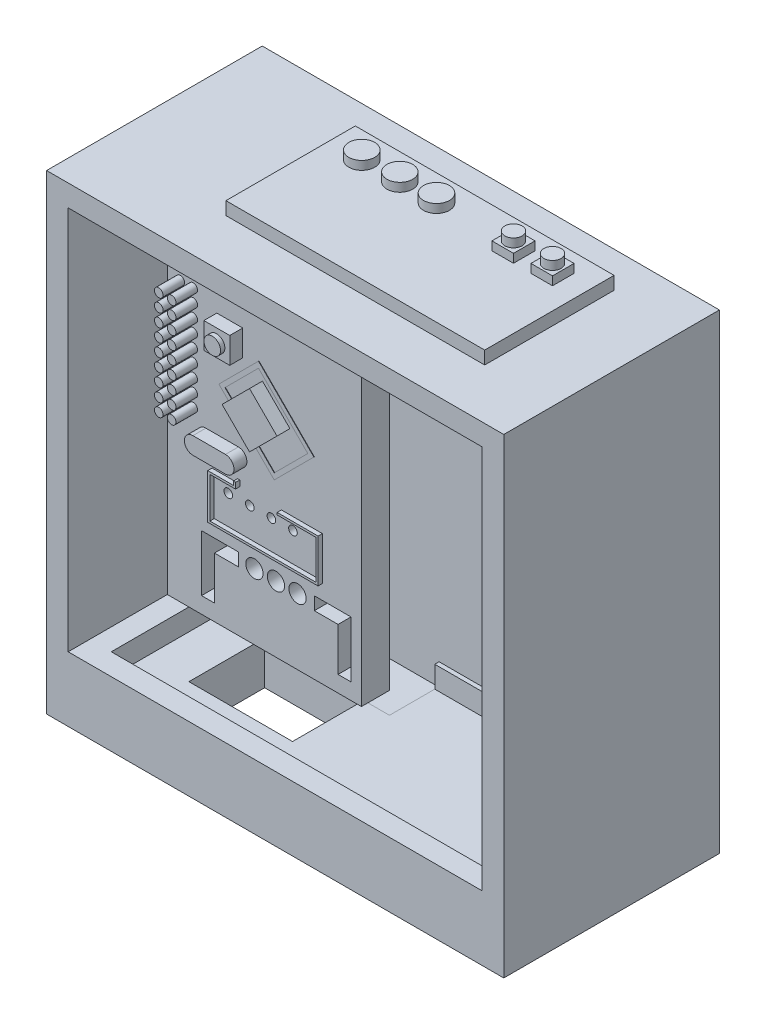
from build123d import *

# Parameters (mm, degrees)
SKETCH_1_W           = 106
SKETCH_1_H           = 45
EXTRUDE_1_DEPTH      = 200
SKETCH_2_W           = 86
SKETCH_2_H           = 180
CUT_EXTRUDE_1_DEPTH  = 35
SKETCH_4_W           = 24.030592061
SKETCH_4_H           = 7.207958271
CUT_EXTRUDE_4_DEPTH  = 35
SKETCH_5_W           = 106
SKETCH_5_H           = 200
EXTRUDE_2_DEPTH      = 5
SKETCH_6_W           = 96
SKETCH_6_H           = 180
CUT_EXTRUDE_5_DEPTH  = 41
SKETCH_7_W           = 45
SKETCH_7_H           = 70
EXTRUDE_3_DEPTH      = 18
SKETCH_8_W           = 24.030592061
SKETCH_8_H           = 17.559762173
CUT_EXTRUDE_6_DEPTH  = 15
SKETCH_9_R           = 3.5
CUT_EXTRUDE_7_DEPTH  = 211.926527492
SKETCH_11_W          = 6
SKETCH_11_H          = 6
SKETCH_11_R          = 1.925381926
EXTRUDE_5_DEPTH      = 3
SKETCH_12_R          = 1.925381926
EXTRUDE_6_DEPTH      = 1
EXTRUDE_7_DEPTH      = 3
EXTRUDE_12_DEPTH     = 3
SKETCH_23_R          = 2
CUT_EXTRUDE_8_DEPTH  = 12
EXTRUDE_1_2_DEPTH    = 0.1
SKETCH_25_W          = 45
SKETCH_25_H          = 5
CUT_EXTRUDE_9_DEPTH  = 75.1
SKETCH_26_W          = 45
SKETCH_26_H          = 6.5
CUT_EXTRUDE_10_DEPTH = 75.1
EXTRUDE_4_DEPTH      = 5
EXTRUDE_4_DEPTH_BACK = 15.1
SKETCH_10_R          = 1
EXTRUDE_14_DEPTH     = 1
SKETCH_28_R          = 1
CUT_EXTRUDE_11_DEPTH = 12.1
SKETCH_39_R          = 6
EXTRUDE_22_DEPTH     = 60
SKETCH_40_W          = 7.376516637
SKETCH_40_H          = 1.927531986
CUT_EXTRUDE_12_DEPTH = 23
SKETCH_41_W          = 4.263187749
SKETCH_41_H          = 1.482847913
CUT_EXTRUDE_13_DEPTH = 23
EXTRUDE_23_DEPTH     = 200
SKETCH_43_R          = 5.333844502
EXTRUDE_24_DEPTH     = 200
CUT_EXTRUDE_14_DEPTH = 207
SKETCH_48_W          = 106
SKETCH_48_H          = 95.860653934
CUT_EXTRUDE_17_DEPTH = 213.859108332
SKETCH_49_W          = 106
SKETCH_49_H          = 50
EXTRUDE_25_DEPTH     = 5
SKETCH_50_W          = 60
SKETCH_50_H          = 30
EXTRUDE_26_DEPTH     = 3
SKETCH_51_R          = 3
EXTRUDE_27_DEPTH     = 2
SKETCH_52_R          = 2.9857654
EXTRUDE_28_DEPTH     = 2
SKETCH_53_R          = 3
EXTRUDE_29_DEPTH     = 2
SKETCH_54_W          = 5
SKETCH_54_H          = 5
EXTRUDE_30_DEPTH     = 2
SKETCH_55_R          = 2
EXTRUDE_31_DEPTH     = 2


with BuildPart() as part:
    # 草圖1 → Extrude 1 (new body)
    with BuildSketch(Plane(origin=(0, 0, 0), x_dir=(1, 0, 0), z_dir=(0, 1, 0))):
        Rectangle(SKETCH_1_W, SKETCH_1_H)
    extrude(amount=EXTRUDE_1_DEPTH)

    # 草圖2 → 除料-伸長1 (cut)
    with BuildSketch(Plane.XY.offset(22.5)):
        with Locations((0, 100)):
            Rectangle(SKETCH_2_W, SKETCH_2_H)
    extrude(amount=-CUT_EXTRUDE_1_DEPTH, mode=Mode.SUBTRACT)

    # 草圖4 → 除料-伸長4 (cut)
    with BuildSketch(Plane.XZ):
        with Locations((-20.984703969, 10.896020865)):
            Rectangle(SKETCH_4_W, SKETCH_4_H)
    extrude(amount=-CUT_EXTRUDE_4_DEPTH, mode=Mode.SUBTRACT)

    # 草圖5 → 填料-伸長2 (add)
    with BuildSketch(Plane.XY.offset(22.5)):
        with Locations((0, 100)):
            Rectangle(SKETCH_5_W, SKETCH_5_H)
    extrude(amount=EXTRUDE_2_DEPTH)

    # 草圖6 → 除料-伸長5 (cut)
    with BuildSketch(Plane.XY.offset(27.5)):
        with Locations((0, 105)):
            Rectangle(SKETCH_6_W, SKETCH_6_H)
    extrude(amount=-CUT_EXTRUDE_5_DEPTH, mode=Mode.SUBTRACT)

    # 草圖7 → 填料-伸長3 (add)
    with BuildSketch(Plane.XY.offset(-13.5)):
        with Locations((-25.5, 50)):
            Rectangle(SKETCH_7_W, SKETCH_7_H)
    extrude(amount=EXTRUDE_3_DEPTH)

    # 草圖8 → 除料-伸長6 (cut)
    with BuildSketch(Plane.XZ):
        with Locations((-20.984703969, 5.720118914)):
            Rectangle(SKETCH_8_W, SKETCH_8_H)
    extrude(amount=-CUT_EXTRUDE_6_DEPTH, mode=Mode.SUBTRACT)

    # 草圖9 → 除料-伸長7 (cut, through all)
    with BuildSketch(Plane.XY.offset(-13.5)):
        with Locations((-34, 185)):
            Circle(SKETCH_9_R)
        with Locations((-34, 175)):
            Circle(SKETCH_9_R)
        with Locations((34, 185)):
            Circle(SKETCH_9_R)
        with Locations((34, 175)):
            Circle(SKETCH_9_R)
    extrude(amount=-CUT_EXTRUDE_7_DEPTH, mode=Mode.SUBTRACT)

    # 草圖11 → 填料-伸長5 (add)
    with BuildSketch(Plane.XY.offset(4.5)):
        with Locations((-33.531491055, 74.249874948)):
            Rectangle(SKETCH_11_W, SKETCH_11_H)
        with Locations((-33.592516199, 74.152122505)):
            Circle(SKETCH_11_R, mode=Mode.SUBTRACT)
    extrude(amount=EXTRUDE_5_DEPTH)

    # 草圖14 → 填料-伸長7 (add)
    with BuildSketch(Plane.XY.offset(4.5)):
        Polygon((-32.310272291, 62.520068569), (-25.94631126, 68.8840296), (-19.582350229, 62.520068569), (-25.94631126, 56.156107538), align=None)
    extrude(amount=EXTRUDE_7_DEPTH)

    # 草圖22 → 填料-伸長12 (add)
    with BuildSketch(Plane.XY.offset(4.5)):
        with BuildLine():
            Line((-39.077631077, 52.868588224), (-31.528611444, 52.868588224))
            ThreePointArc((-31.528611444, 52.868588224), (-29.551487254, 50.891464034), (-31.528611444, 48.914339844))
            Line((-31.528611444, 48.914339844), (-39.077631077, 48.914339844))
            ThreePointArc((-39.077631077, 48.914339844), (-41.054755267, 50.891464034), (-39.077631077, 52.868588224))
        make_face()
    extrude(amount=EXTRUDE_12_DEPTH)

    # 草圖23 → 除料-伸長8 (cut)
    with BuildSketch(Plane.XY.offset(4.5)):
        with Locations((-27.814678515, 30.288524887)):
            Circle(SKETCH_23_R)
        with Locations((-22.814678515, 30.288524887)):
            Circle(SKETCH_23_R)
        with Locations((-17.814678515, 30.288524887)):
            Circle(SKETCH_23_R)
        Polygon((-40.074393657, 18.743194454), (-37.074393657, 18.743194454), (-37.074393657, 28.788524887), (-31.464475571, 28.788524887), (-31.464475571, 31.788524887), (-40.074393657, 31.788524887), align=None)
        Polygon((-8.423476487, 18.743194454), (-5.423476487, 18.743194454), (-5.423476487, 31.788524887), (-13.928865075, 31.788524887), (-13.928865075, 28.788524887), (-8.423476487, 28.788524887), align=None)
    extrude(amount=-CUT_EXTRUDE_8_DEPTH, mode=Mode.SUBTRACT)

    # 草圖24 → Extrude 1 2 (add)
    with BuildSketch(Plane.XY.offset(4.5)):
        Polygon((-26.761137533, 72.527282997), (-35.953525689, 63.334894842), (-23.117884135, 50.499253289), (-13.92549598, 59.691641444), align=None)
        Polygon((-26.761137533, 71.113069435), (-34.539312126, 63.334894842), (-23.117884135, 51.913466851), (-15.339709542, 59.691641444), align=None, mode=Mode.SUBTRACT)
    extrude(amount=EXTRUDE_1_2_DEPTH)

    # 草圖25 → 除料-伸長9 (cut)
    with BuildSketch(Plane(origin=(0, 85, 0), x_dir=(1, 0, 0), z_dir=(0, 1, 0))):
        with Locations((-25.5, 11)):
            Rectangle(SKETCH_25_W, SKETCH_25_H)
    extrude(amount=-CUT_EXTRUDE_9_DEPTH, mode=Mode.SUBTRACT)

    # 草圖26 → 除料-伸長10 (cut)
    with BuildSketch(Plane(origin=(0, 85, 0), x_dir=(1, 0, 0), z_dir=(0, 1, 0))):
        with Locations((-25.5, 5.25)):
            Rectangle(SKETCH_26_W, SKETCH_26_H)
    extrude(amount=-CUT_EXTRUDE_10_DEPTH, mode=Mode.SUBTRACT)

    # 草圖10 → 填料-伸長4 (add, two sides: drawn at the far end of the back side and taken through both)
    with BuildSketch(Plane.XY.offset(4.5).offset(-EXTRUDE_4_DEPTH_BACK)):
        with Locations((-45, 79.595847046)):
            Circle(SKETCH_10_R)
        with Locations((-42, 79.595847046)):
            Circle(SKETCH_10_R)
        with Locations((-45, 76.595847046)):
            Circle(SKETCH_10_R)
        with Locations((-42, 76.595847046)):
            Circle(SKETCH_10_R)
        with Locations((-45, 73.595847046)):
            Circle(SKETCH_10_R)
        with Locations((-42, 73.595847046)):
            Circle(SKETCH_10_R)
        with Locations((-45, 70.595847046)):
            Circle(SKETCH_10_R)
        with Locations((-42, 70.595847046)):
            Circle(SKETCH_10_R)
        with Locations((-45, 67.595847046)):
            Circle(SKETCH_10_R)
        with Locations((-42, 67.595847046)):
            Circle(SKETCH_10_R)
        with Locations((-45, 64.595847046)):
            Circle(SKETCH_10_R)
        with Locations((-42, 64.595847046)):
            Circle(SKETCH_10_R)
        with Locations((-45, 61.595847046)):
            Circle(SKETCH_10_R)
        with Locations((-42, 61.595847046)):
            Circle(SKETCH_10_R)
        with Locations((-45, 58.595847046)):
            Circle(SKETCH_10_R)
        with Locations((-42, 58.595847046)):
            Circle(SKETCH_10_R)
        with Locations((-45, 55.595847046)):
            Circle(SKETCH_10_R)
        with Locations((-42, 55.595847046)):
            Circle(SKETCH_10_R)
    extrude(amount=EXTRUDE_4_DEPTH + EXTRUDE_4_DEPTH_BACK)

    # 草圖27 → 填料-伸長14 (add)
    with BuildSketch(Plane.XY.offset(4.5)):
        Polygon((-31.203920225, 46.418342211), (-31.203920225, 45.064584038), (-37.135292794, 45.064584038), (-37.135292794, 35.684682041), (-12.561763296, 35.684682041), (-12.561763296, 44.710825865), (-21.548691432, 44.710825865), (-21.548691432, 45.210825865), (-12.061763296, 45.210825865), (-12.061763296, 35.184682041), (-37.635292794, 35.184682041), (-37.635292794, 45.564584038), (-31.703920225, 45.564584038), (-31.703920225, 46.418342211), align=None)
    extrude(amount=EXTRUDE_14_DEPTH)

    # 草圖28 → 除料-伸長11 (cut)
    with BuildSketch(Plane.XY.offset(4.5)):
        with Locations((-33.875530331, 42.407908174)):
            Circle(SKETCH_28_R)
        with Locations((-28.875530331, 42.407908174)):
            Circle(SKETCH_28_R)
        with Locations((-23.875530331, 42.407908174)):
            Circle(SKETCH_28_R)
        with Locations((-18.875530331, 42.407908174)):
            Circle(SKETCH_28_R)
    extrude(amount=-CUT_EXTRUDE_11_DEPTH, mode=Mode.SUBTRACT)

    # 草圖39 → 填料-伸長22 (add)
    with BuildSketch(Plane(origin=(0, 10, 0), x_dir=(1, 0, 0), z_dir=(0, 1, 0))):
        with Locations(Location((36, 5.5, 0), (0, 0, 90))):
            Circle(SKETCH_39_R)
    extrude(amount=EXTRUDE_22_DEPTH)

    # 草圖40 → 除料-伸長12 (cut)
    with BuildSketch(Plane(origin=(0, 70, 0), x_dir=(1, 0, 0), z_dir=(0, 1, 0))):
        with Locations((36.148613536, 2.965589645)):
            Rectangle(SKETCH_40_W, SKETCH_40_H)
    extrude(amount=-CUT_EXTRUDE_12_DEPTH, mode=Mode.SUBTRACT)

    # 草圖41 → 除料-伸長13 (cut)
    with BuildSketch(Plane(origin=(0, 70, 0), x_dir=(1, 0, 0), z_dir=(0, 1, 0))):
        with Locations((35.864121862, 8.188311076)):
            Rectangle(SKETCH_41_W, SKETCH_41_H)
    extrude(amount=-CUT_EXTRUDE_13_DEPTH, mode=Mode.SUBTRACT)



with BuildPart() as body_2:
    # 草圖12 → 填料-伸長6 (new body)
    with BuildSketch(Plane.XY.offset(7.5)):
        with Locations((-33.592516199, 74.152122505)):
            Circle(SKETCH_12_R)
    extrude(amount=EXTRUDE_6_DEPTH)


with BuildPart() as body_3:
    # 草圖42 → 填料-伸長23 (new body)
    with BuildSketch(Plane(origin=(0, 0, 0), x_dir=(1, 0, 0), z_dir=(0, 1, 0))):
        Polygon((-59.749343763, -30.11222935), (-55.785294408, -34.076278705), (-109.158387509, -87.449371805), (-113.122436863, -83.48532245), align=None)
    extrude(amount=EXTRUDE_23_DEPTH)


with BuildPart() as part_1:
    add(part.part)

    add(body_3.part)  # 填料-伸長24 merges body 3
    # 草圖43 → 填料-伸長24 (add)
    with BuildSketch(Plane(origin=(0, 200, 0), x_dir=(1, 0, 0), z_dir=(0, 1, 0))):
        with Locations((-56.348974797, -28.857914054)):
            Circle(SKETCH_43_R)
    extrude(amount=-EXTRUDE_24_DEPTH)

    # 草圖45 → 除料-伸長14 (cut)
    with BuildSketch(Plane(origin=(0, 200, 0), x_dir=(1, 0, 0), z_dir=(0, 1, 0))):
        Polygon((-51.19087761, -27.5), (-45.622451664, -33.068425945), (-108.609633107, -96.055607388), (-126.793281858, -77.871958636), (-59.105565365, -19.585312245), (-53, -24.706496828), (-53, -27.5), align=None)
    extrude(amount=-CUT_EXTRUDE_14_DEPTH, mode=Mode.SUBTRACT)

    # 草圖48 → 除料-伸長17 (cut, through all)
    with BuildSketch(Plane.XY.offset(27.5)):
        with Locations((0, 152.069673033)):
            Rectangle(SKETCH_48_W, SKETCH_48_H)
    extrude(amount=-CUT_EXTRUDE_17_DEPTH, mode=Mode.SUBTRACT)

    # 草圖49 → 填料-伸長25 (add)
    with BuildSketch(Plane(origin=(0, 104.139346066, 0), x_dir=(1, 0, 0), z_dir=(0, 1, 0))):
        with Locations((0, -2.5)):
            Rectangle(SKETCH_49_W, SKETCH_49_H)
    extrude(amount=EXTRUDE_25_DEPTH)

    # 草圖50 → 填料-伸長26 (add)
    with BuildSketch(Plane(origin=(0, 109.139346066, 0), x_dir=(1, 0, 0), z_dir=(0, 1, 0))):
        with Locations((6.84333923, -0.763550865)):
            Rectangle(SKETCH_50_W, SKETCH_50_H)
    extrude(amount=EXTRUDE_26_DEPTH)

    # 草圖51 → 填料-伸長27 (add)
    with BuildSketch(Plane(origin=(0, 112.139346066, 0), x_dir=(1, 0, 0), z_dir=(0, 1, 0))):
        with Locations(Location((-15.606962196, 8.187376286, 0), (0, 0, 270))):
            Circle(SKETCH_51_R)
    extrude(amount=EXTRUDE_27_DEPTH)

    # 草圖52 → 填料-伸長28 (add)
    with BuildSketch(Plane(origin=(0, 112.139346066, 0), x_dir=(1, 0, 0), z_dir=(0, 1, 0))):
        with Locations(Location((-6.785635737, 8.187376286, 0), (0, 0, 270))):
            Circle(SKETCH_52_R)
    extrude(amount=EXTRUDE_28_DEPTH)

    # 草圖53 → 填料-伸長29 (add)
    with BuildSketch(Plane(origin=(0, 112.139346066, 0), x_dir=(1, 0, 0), z_dir=(0, 1, 0))):
        with Locations(Location((1.714364263, 8.187376286, 0), (0, 0, 270))):
            Circle(SKETCH_53_R)
    extrude(amount=EXTRUDE_29_DEPTH)

    # 草圖54 → 填料-伸長30 (add)
    with BuildSketch(Plane(origin=(0, 112.139346066, 0), x_dir=(1, 0, 0), z_dir=(0, 1, 0))):
        with Locations((20.255746846, 7.49687915)):
            Rectangle(SKETCH_54_W, SKETCH_54_H)
        with Locations((29.303261163, 7.49687915)):
            Rectangle(SKETCH_54_W, SKETCH_54_H)
    extrude(amount=EXTRUDE_30_DEPTH)

    # 草圖55 → 填料-伸長31 (add)
    with BuildSketch(Plane(origin=(0, 114.139346066, 0), x_dir=(1, 0, 0), z_dir=(0, 1, 0))):
        with Locations(Location((29.303261163, 7.49687915, 0), (0, 0, 270))):
            Circle(SKETCH_55_R)
        with Locations(Location((20.255746846, 7.49687915, 0), (0, 0, 270))):
            Circle(SKETCH_55_R)
    extrude(amount=EXTRUDE_31_DEPTH)


solid = Compound([body_2.part, part_1.part])
